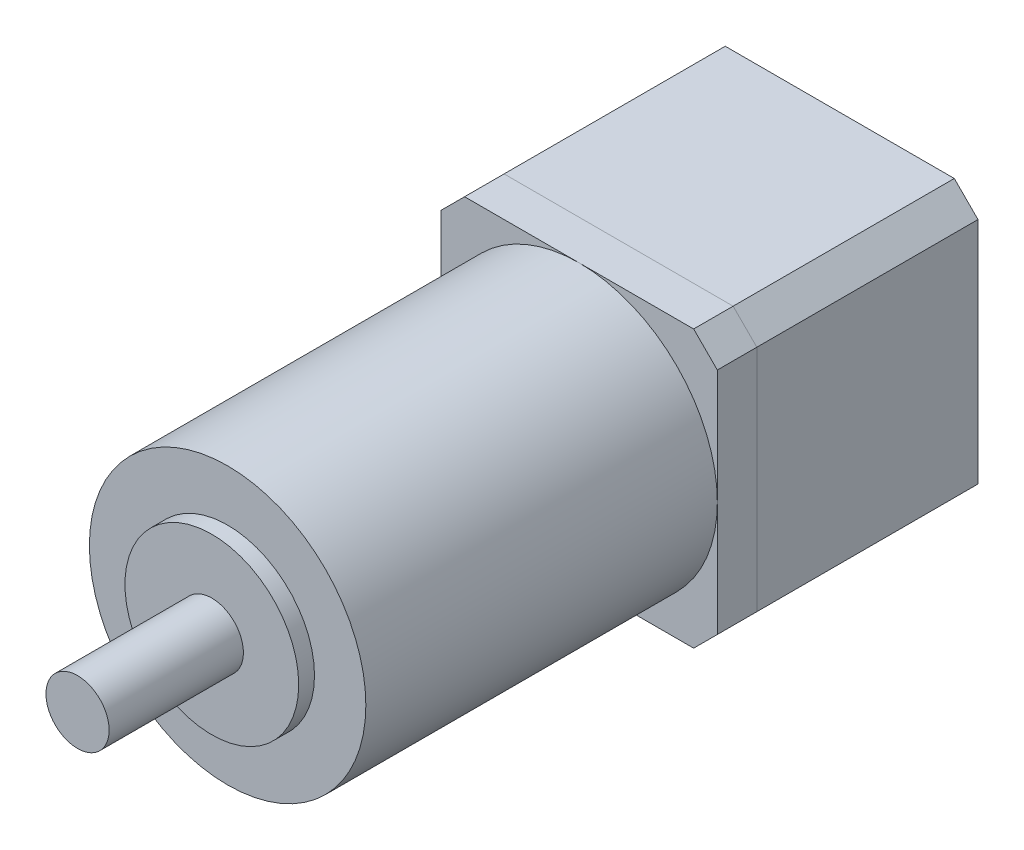
from build123d import *

# Parameters (mm, degrees)
SKETCH1_W           = 35
SKETCH1_H           = 35
BOSS_EXTRUDE1_DEPTH = 28
CHAMFER1_SIZE       = 3
BOSS_EXTRUDE2_DEPTH = 5
SKETCH3_R           = 17.5
BOSS_EXTRUDE3_DEPTH = 44.5
SKETCH4_R           = 11
BOSS_EXTRUDE4_DEPTH = 2
SKETCH5_R           = 4
BOSS_EXTRUDE5_DEPTH = 17


with BuildPart() as part:
    # Sketch1 → Boss-Extrude1 (new body)
    with BuildSketch(Plane.XY):
        Rectangle(SKETCH1_W, SKETCH1_H)
    extrude(amount=BOSS_EXTRUDE1_DEPTH)

    # Chamfer1
    chamfer1_edges = [part.edges().sort_by_distance(p)[0] for p in [
        (17.5, -17.5, 14),
        (-17.5, -17.5, 14),
        (-17.5, 17.5, 14),
        (17.5, 17.5, 14),
    ]]
    chamfer(chamfer1_edges, length=CHAMFER1_SIZE)


with BuildPart() as body_2:
    # Sketch2 → Boss-Extrude2 (new body)
    with BuildSketch(Plane.XY.offset(28)):
        Polygon((-14.5, -17.5), (14.5, -17.5), (17.5, -14.5), (17.5, 14.5), (14.5, 17.5), (-14.5, 17.5), (-17.5, 14.5), (-17.5, -14.5), align=None)
    extrude(amount=BOSS_EXTRUDE2_DEPTH)


with BuildPart() as body_3:
    # Sketch3 → Boss-Extrude3 (new body)
    with BuildSketch(Plane.XY.offset(33)):
        Circle(SKETCH3_R)
    extrude(amount=BOSS_EXTRUDE3_DEPTH)

    # Sketch4 → Boss-Extrude4 (add)
    with BuildSketch(Plane.XY.offset(77.5)):
        Circle(SKETCH4_R)
    extrude(amount=BOSS_EXTRUDE4_DEPTH)


with BuildPart() as body_4:
    # Sketch5 → Boss-Extrude5 (new body)
    with BuildSketch(Plane.XY.offset(79.5)):
        Circle(SKETCH5_R)
    extrude(amount=BOSS_EXTRUDE5_DEPTH)


solid = Compound([part.part, body_2.part, body_3.part, body_4.part])
